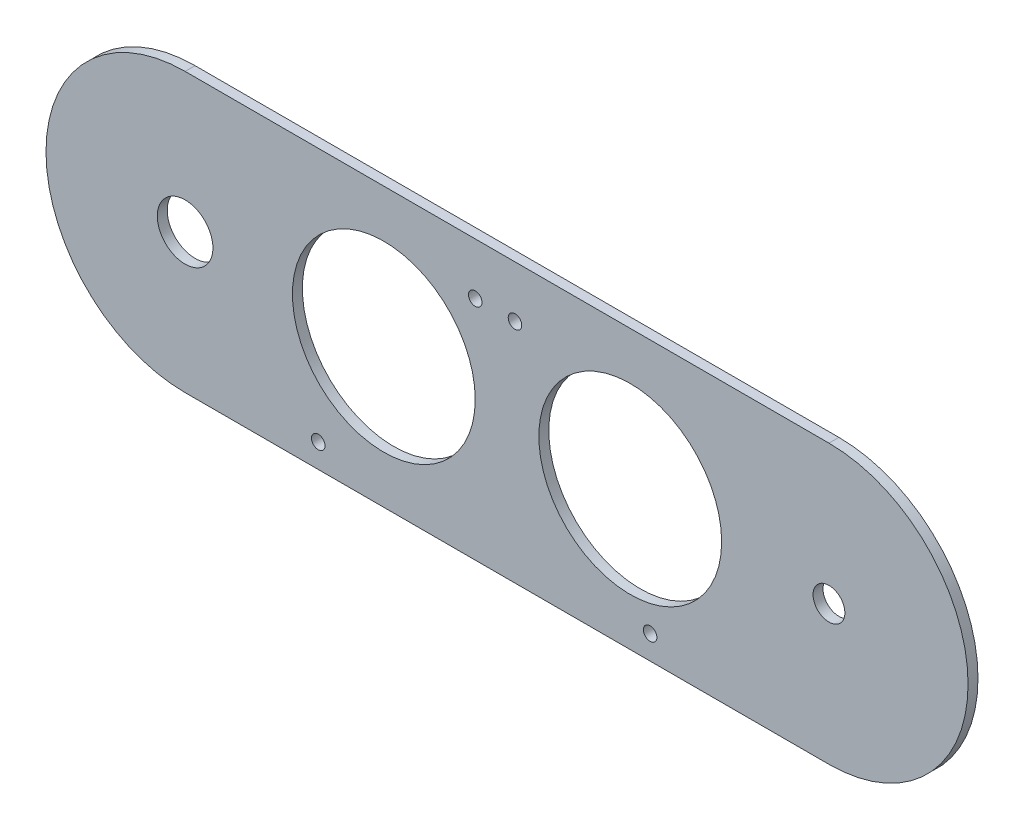
from build123d import *

# Parameters (mm, degrees)
ESQUISSE2_R                = 7
ESQUISSE2_R_2              = 4
ESQUISSE2_R_3              = 23
BASE_EXTRUSION_DEPTH       = 2.5
ESQUISSE9_R                = 1.7
ENL_V_MAT_EXTRU_2_DEPTH    = 146.323213238
R_P_TITION_LIN_AIRE1_COUNT = 2
R_P_TITION_LIN_AIRE1_PITCH = 10
ESQUISSE10_R               = 1.7
ENL_V_MAT_EXTRU_3_DEPTH    = 146.323213238
R_P_TITION_LIN_AIRE2_COUNT = 2
R_P_TITION_LIN_AIRE2_PITCH = 83.5


with BuildPart() as part:
    # Esquisse2 → Base-Extrusion (new body)
    with BuildSketch(Plane.XY):
        with BuildLine():
            Line((-60.587831126, 50.043046358), (101.412168874, 50.043046358))
            ThreePointArc((101.412168874, 50.043046358), (136.412168874, 15.043046358), (101.412168874, -19.956953642))
            Line((101.412168874, -19.956953642), (-60.587831126, -19.956953642))
            ThreePointArc((-60.587831126, -19.956953642), (-95.587831126, 15.043046358), (-60.587831126, 50.043046358))
        make_face()
        with Locations((-60.587831126, 15.043046358)):
            Circle(ESQUISSE2_R, mode=Mode.SUBTRACT)
        with Locations((101.412168874, 15.043046358)):
            Circle(ESQUISSE2_R_2, mode=Mode.SUBTRACT)
        with Locations((51.412168874, 15.043046358)):
            Circle(ESQUISSE2_R_3, mode=Mode.SUBTRACT)
        with Locations((-10.587831126, 15.043046358)):
            Circle(ESQUISSE2_R_3, mode=Mode.SUBTRACT)
    extrude(amount=BASE_EXTRUSION_DEPTH)

    # Esquisse9 → Enlèv. mat.-Extru.2 (cut, through all)
    with BuildSketch(Plane.XY.offset(2.5)):
        with Locations((12.412168874, 37.043046358)):
            Circle(ESQUISSE9_R)
    enl_v_mat_extru_2 = extrude(amount=-ENL_V_MAT_EXTRU_2_DEPTH, mode=Mode.SUBTRACT)

    # Répétition linéaire1: Enlèv. mat.-Extru.2 ×2
    with Locations(*[(i * R_P_TITION_LIN_AIRE1_PITCH, 0, 0) for i in range(1, R_P_TITION_LIN_AIRE1_COUNT)]):
        add(enl_v_mat_extru_2, mode=Mode.SUBTRACT)

    # Esquisse10 → Enlèv. mat.-Extru.3 (cut, through all)
    with BuildSketch(Plane.XY.offset(2.5)):
        with Locations((-27.087831126, -13.956953642)):
            Circle(ESQUISSE10_R)
    enl_v_mat_extru_3 = extrude(amount=-ENL_V_MAT_EXTRU_3_DEPTH, mode=Mode.SUBTRACT)

    # Répétition linéaire2: Enlèv. mat.-Extru.3 ×2
    with Locations(*[(i * R_P_TITION_LIN_AIRE2_PITCH, 0, 0) for i in range(1, R_P_TITION_LIN_AIRE2_COUNT)]):
        add(enl_v_mat_extru_3, mode=Mode.SUBTRACT)


solid = part.part
